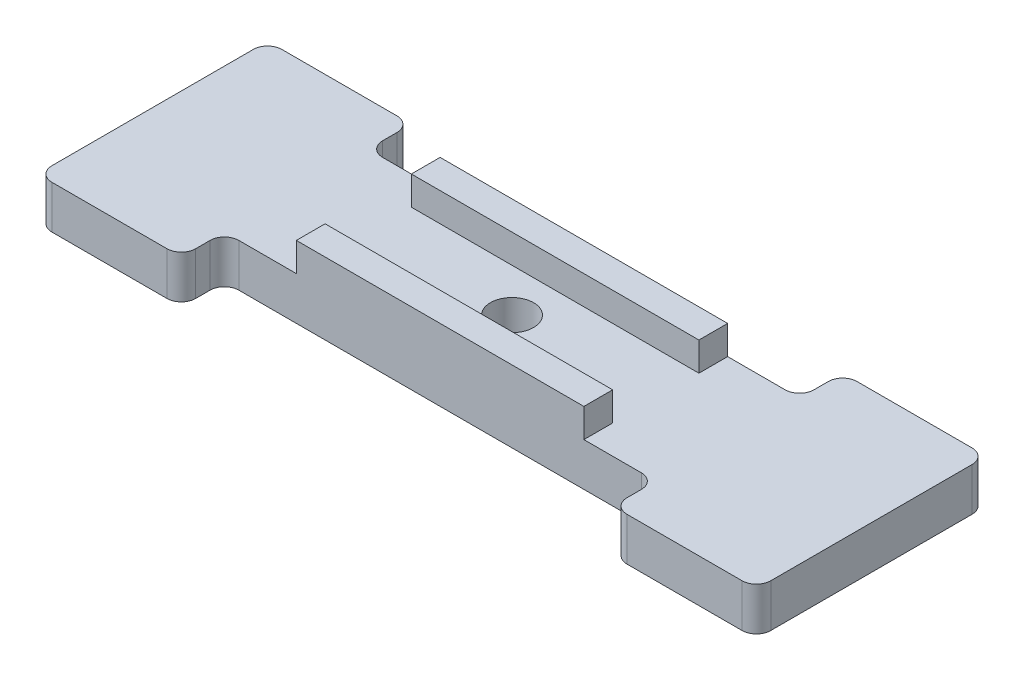
from build123d import *

# Parameters (mm, degrees)
CROQUIS1_R              = 1.5
SALIENTE_EXTRUIR1_DEPTH = 3
CROQUIS2_W              = 20
CROQUIS2_H              = 2
SALIENTE_EXTRUIR2_DEPTH = 2
REDONDEO1_R             = 1


with BuildPart() as part:
    # Croquis1 → Saliente-Extruir1 (new body)
    with BuildSketch(Plane(origin=(0, 0, 0), x_dir=(1, 0, 0), z_dir=(0, 1, 0))):
        Polygon((-15, -5), (15, -5), (15, -8), (25, -8), (25, 8), (15, 8), (15, 5), (-15, 5), (-15, 8), (-25, 8), (-25, -8), (-15, -8), align=None)
        with Locations(Location((0, 0, 0), (0, 0, 270))):
            Circle(CROQUIS1_R, mode=Mode.SUBTRACT)
    extrude(amount=SALIENTE_EXTRUIR1_DEPTH)

    # Croquis2 → Saliente-Extruir2 (add)
    with BuildSketch(Plane(origin=(0, 3, 0), x_dir=(1, 0, 0), z_dir=(0, 1, 0))):
        with Locations((0, 4)):
            Rectangle(CROQUIS2_W, CROQUIS2_H)
        with Locations((0, -4)):
            Rectangle(CROQUIS2_W, CROQUIS2_H)
    extrude(amount=SALIENTE_EXTRUIR2_DEPTH)

    # Redondeo1
    redondeo1_edges = [part.edges().sort_by_distance(p)[0] for p in [
        (-15, 1.5, -8),
        (-15, 1.5, -5),
        (15, 1.5, -5),
        (15, 1.5, -8),
        (25, 1.5, -8),
        (25, 1.5, 8),
        (15, 1.5, 8),
        (15, 1.5, 5),
        (-15, 1.5, 5),
        (-15, 1.5, 8),
        (-25, 1.5, 8),
        (-25, 1.5, -8),
    ]]
    fillet(redondeo1_edges, radius=REDONDEO1_R)


solid = part.part
